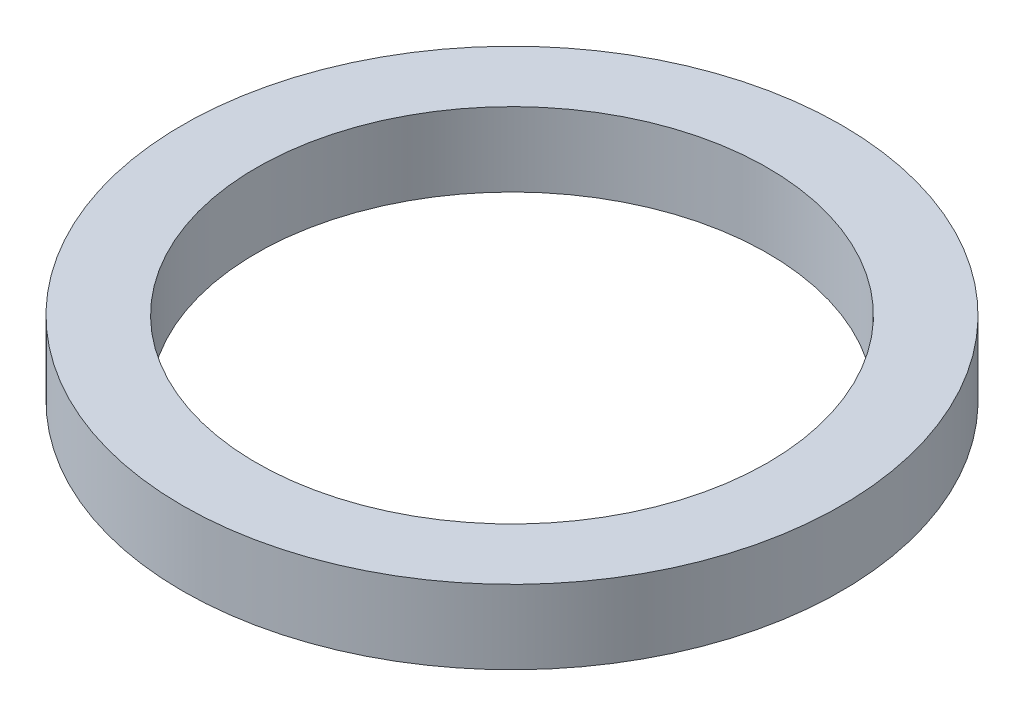
from build123d import *

# Parameters (mm, degrees)
SKETCH1_R           = 66.908045
SKETCH1_R_2         = 51.891565
EXTRUDE_THIN1_DEPTH = 15.01648


with BuildPart() as part:
    # Sketch1 → Extrude-Thin1 (new body)
    with BuildSketch(Plane(origin=(0, 0, 0), x_dir=(1, 0, 0), z_dir=(0, 1, 0))):
        Circle(SKETCH1_R)
        Circle(SKETCH1_R_2, mode=Mode.SUBTRACT)
    extrude(amount=EXTRUDE_THIN1_DEPTH)


solid = part.part
